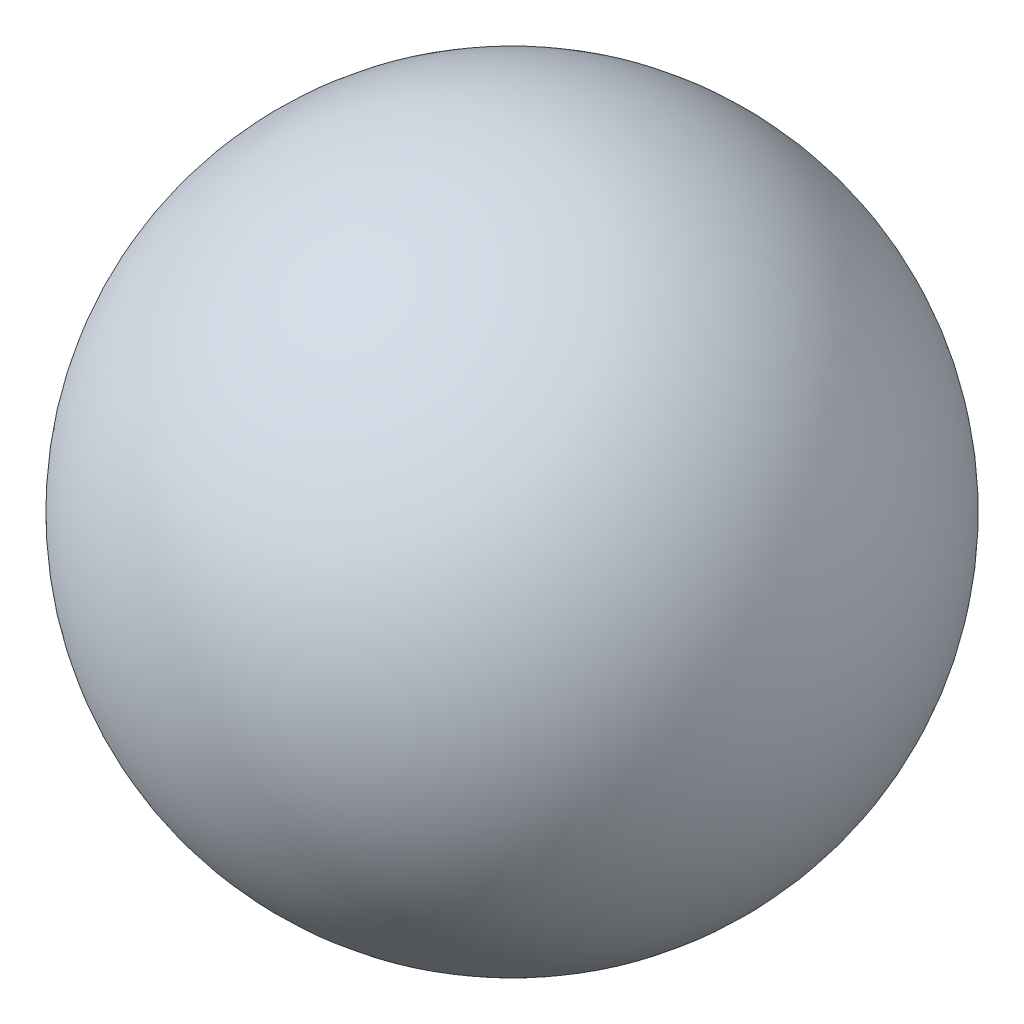
from build123d import *


with BuildPart() as part:
    # Croquis1 → Revolución4 (revolve)
    with BuildSketch(Plane.XY):
        with BuildLine():
            Line((0, 4), (0, -4))
            ThreePointArc((0, -4), (4, 0), (0, 4))
        make_face()
    revolve(axis=Axis((0, 4, 0), (0, -1, 0)))


solid = part.part
